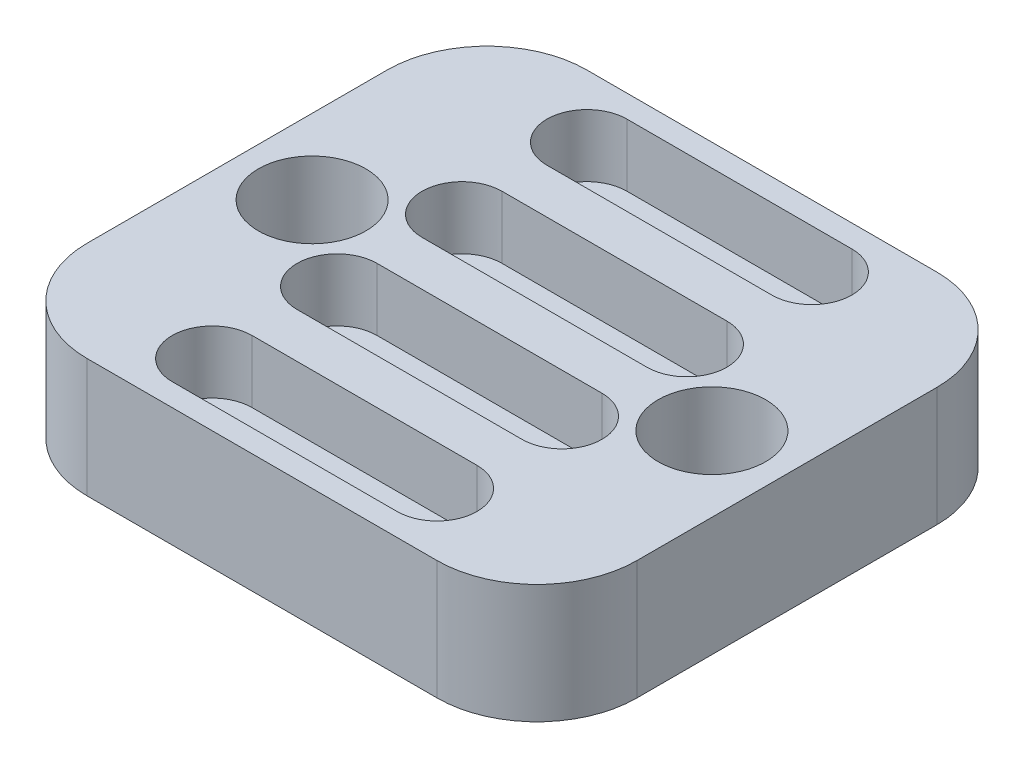
from build123d import *

# Parameters (mm, degrees)
BOSS_EXTRUDE1_DEPTH = 4.5
SKETCH3_W           = 6.5
SKETCH3_H           = 20
SKETCH3_R           = 2.15265
BOSS_EXTRUDE2_DEPTH = 4.7625
CUT_EXTRUDE1_DEPTH  = 2.5
FILLET1_R           = 4


with BuildPart() as part:
    # Sketch1 → Boss-Extrude1 (new, symmetric)
    with BuildSketch(Plane(origin=(0, 0, 0), x_dir=(0, 0, -1), z_dir=(1, 0, 0))):
        Polygon((5.9, 2.2625), (5.9, 4.7625), (4.1, 4.7625), (4.1, 2.2625), (0.9, 2.2625), (0.9, 4.7625), (0, 4.7625), (0, 0), (20, 0), (20, 4.7625), (19.1, 4.7625), (19.1, 2.2625), (15.9, 2.2625), (15.9, 4.7625), (14.1, 4.7625), (14.1, 2.2625), (10.9, 2.2625), (10.9, 4.7625), (9.1, 4.7625), (9.1, 2.2625), align=None)
    extrude(amount=BOSS_EXTRUDE1_DEPTH, both=True)

    # Sketch3 → Boss-Extrude2 (add)
    # profile 1 of 2: a face of its own
    with BuildSketch(Plane.XZ):
        with Locations((7.75, -10)):
            Rectangle(SKETCH3_W, SKETCH3_H)
        with Locations(Location((8, -10, 0), (0, 0, 270))):
            Circle(SKETCH3_R, mode=Mode.SUBTRACT)
    # profile 2 of 2: a face of its own
    with BuildSketch(Plane.XZ):
        with Locations((-7.75, -10)):
            Rectangle(SKETCH3_W, SKETCH3_H)
        with Locations(Location((-8, -10, 0), (0, 0, 270))):
            Circle(SKETCH3_R, mode=Mode.SUBTRACT)
    extrude(amount=-BOSS_EXTRUDE2_DEPTH)

    # Sketch4 → Cut-Extrude1 (cut)
    with BuildSketch(Plane(origin=(0, 4.7625, 0), x_dir=(1, 0, 0), z_dir=(0, 1, 0))):
        with BuildLine():
            Line((4.5, 0.9), (4.5, 4.1))
            ThreePointArc((4.5, 4.1), (6.1, 2.5), (4.5, 0.9))
        make_face()
        with BuildLine():
            Line((4.5, 5.9), (4.5, 9.1))
            ThreePointArc((4.5, 9.1), (6.1, 7.5), (4.5, 5.9))
        make_face()
        with BuildLine():
            Line((4.5, 10.9), (4.5, 14.1))
            ThreePointArc((4.5, 14.1), (6.1, 12.5), (4.5, 10.9))
        make_face()
        with BuildLine():
            Line((4.5, 15.9), (4.5, 19.1))
            ThreePointArc((4.5, 19.1), (6.1, 17.5), (4.5, 15.9))
        make_face()
        with BuildLine():
            Line((-4.5, 15.9), (-4.5, 19.1))
            ThreePointArc((-4.5, 19.1), (-6.1, 17.5), (-4.5, 15.9))
        make_face()
        with BuildLine():
            Line((-4.5, 10.9), (-4.5, 14.1))
            ThreePointArc((-4.5, 14.1), (-6.1, 12.5), (-4.5, 10.9))
        make_face()
        with BuildLine():
            Line((-4.5, 5.9), (-4.5, 9.1))
            ThreePointArc((-4.5, 9.1), (-6.1, 7.5), (-4.5, 5.9))
        make_face()
        with BuildLine():
            Line((-4.5, 0.9), (-4.5, 4.1))
            ThreePointArc((-4.5, 4.1), (-6.1, 2.5), (-4.5, 0.9))
        make_face()
    extrude(amount=-CUT_EXTRUDE1_DEPTH, mode=Mode.SUBTRACT)

    # Fillet1
    fillet1_edges = [part.edges().sort_by_distance(p)[0] for p in [
        (11, 2.38125, 0),
        (11, 2.38125, -20),
        (-11, 2.38125, -20),
        (-11, 2.38125, 0),
    ]]
    fillet(fillet1_edges, radius=FILLET1_R)


solid = part.part
